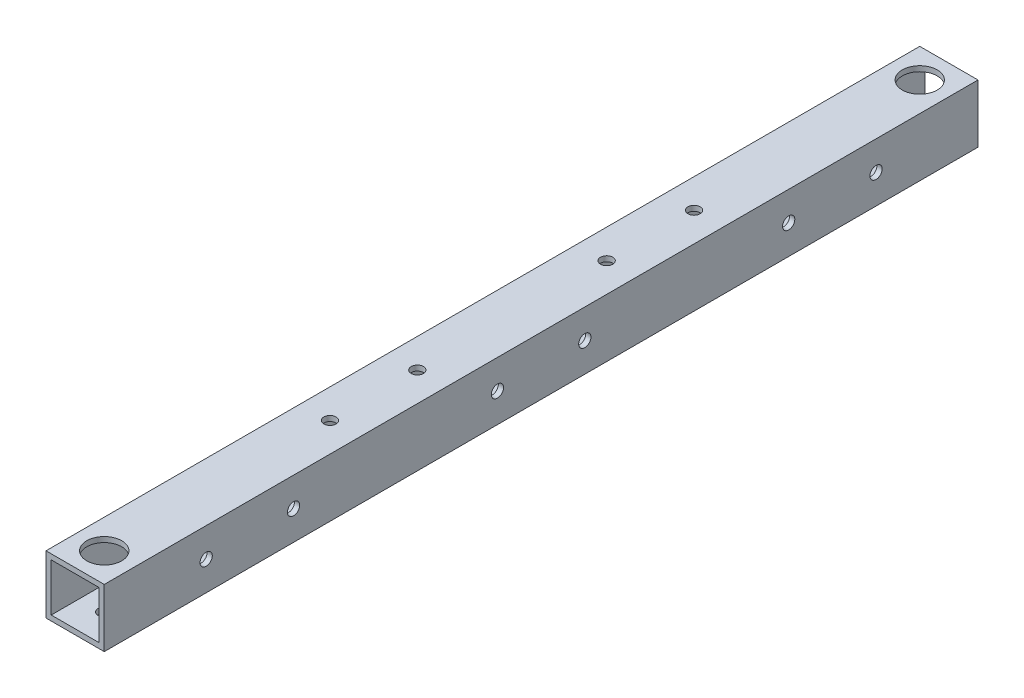
from build123d import *

# Parameters (mm, degrees)
SKETCH_3_W              = 20
SKETCH_3_H              = 20
SKETCH_3_W_2            = 16.4
SKETCH_3_H_2            = 16.4
EXTRUDE_1_DEPTH         = 300
HOLE_WIZARD_4_2_4_2_1_D = 4.2
HOLE_WIZARD_4_2_4_2_2_D = 4.2
HOLE_WIZARD_4_2_4_2_3_D = 4.2
CUT_EXTRUDE_1_REACH     = 303.33
SKETCH_10_R             = 6
HOLE_WIZARD_4_2_4_2_4_D = 4.2


with BuildPart() as part:
    # 草图3 → 凸台-拉伸1 (new body)
    with BuildSketch(Plane.XY):
        with Locations((10, 10)):
            Rectangle(SKETCH_3_W, SKETCH_3_H)
        with Locations((10, 10)):
            Rectangle(SKETCH_3_W_2, SKETCH_3_H_2, mode=Mode.SUBTRACT)
    extrude(amount=-EXTRUDE_1_DEPTH)

    # Ø4.2 (4.2) 直径孔1 (through all)
    with Locations(Plane(origin=(10, 20, -182.5), x_dir=(0, 0, 1), z_dir=(0, 1, 0))):
        with Locations((0, 0), (-30, 0)):
            hole_wizard_4_2_4_2_1 = Hole(HOLE_WIZARD_4_2_4_2_1_D / 2)

    # 镜向1: Ø4.2 (4.2) 直径孔1 across plane
    add(hole_wizard_4_2_4_2_1.mirror(Plane.XY.offset(-150)), mode=Mode.SUBTRACT)

    # Ø4.2 (4.2) 直径孔2 (through all)
    with Locations(Plane(origin=(0, 10, -35), x_dir=(0, 0, -1), z_dir=(-1, 0, 0))):
        with Locations((0, 0), (30, 0)):
            hole_wizard_4_2_4_2_2 = Hole(HOLE_WIZARD_4_2_4_2_2_D / 2)

    # 镜向2: Ø4.2 (4.2) 直径孔2 across plane
    add(hole_wizard_4_2_4_2_2.mirror(Plane.XY.offset(-150)), mode=Mode.SUBTRACT)

    # Ø4.2 (4.2) 直径孔3 (through all)
    with Locations(Plane(origin=(0, 10, -165), x_dir=(0, 0, -1), z_dir=(-1, 0, 0))):
        with Locations((0, 0), (-30, 0)):
            Hole(HOLE_WIZARD_4_2_4_2_3_D / 2)

    # 草图10 → 切除-拉伸1 (cut, up to next)
    with BuildSketch(Plane(origin=(0, 20, 0), x_dir=(1, 0, 0), z_dir=(0, 1, 0)), mode=Mode.PRIVATE) as cut_extrude_1_sk1:
        with Locations(Location((10, 10, 0), (0, 0, 270))):
            Circle(SKETCH_10_R)
    cut_extrude_1_tool1 = extrude(cut_extrude_1_sk1.sketch, amount=-CUT_EXTRUDE_1_REACH, mode=Mode.PRIVATE) & part.part
    cut_extrude_1 = cut_extrude_1_tool1.solids().sort_by_distance((10, 20, -10))[0]
    add(cut_extrude_1, mode=Mode.SUBTRACT)

    # 镜向3: 切除-拉伸1 across plane
    add(cut_extrude_1.mirror(Plane.XY.offset(-150)), mode=Mode.SUBTRACT)

    # Ø4.2 (4.2) 直径孔4 (through all)
    with Locations(Plane(origin=(10, 0, -10), x_dir=(0, 0, -1), z_dir=(0, -1, 0))):
        with Locations((0, 0), (280, 0)):
            Hole(HOLE_WIZARD_4_2_4_2_4_D / 2)


solid = part.part
